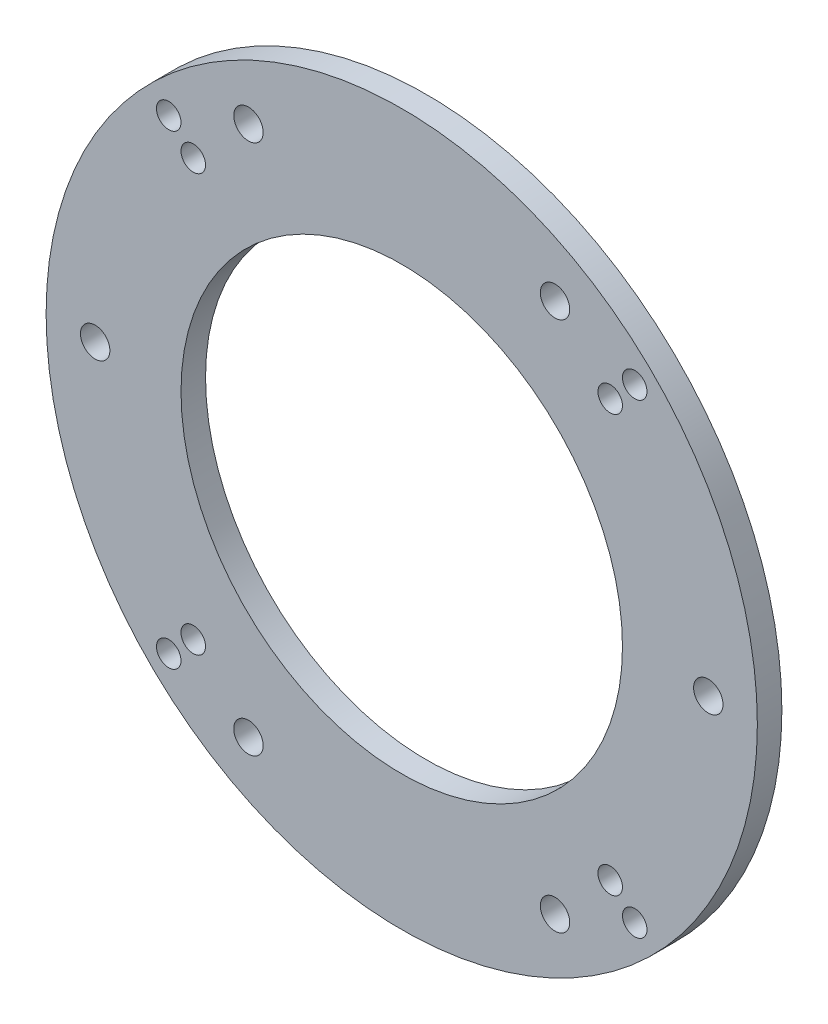
from build123d import *

# Parameters (mm, degrees)
SKETCH1_R             = 18
BOSS_EXTRUDE1_DEPTH   = 2
F_2_0MM_DOWEL_HOLE1_D = 2
SKETCH5_R             = 1.2
CUT_EXTRUDE4_DEPTH    = 42.060930335


with BuildPart() as part:
    # Sketch1 → Boss-Extrude1 (new body)
    with BuildSketch(Plane.XY):
        with BuildLine():
            ThreePointArc((-29, 0), (0, -29), (29, 0))
            ThreePointArc((29, 0), (0, 29), (-29, 0))
        make_face()
        Circle(SKETCH1_R, mode=Mode.SUBTRACT)
    extrude(amount=BOSS_EXTRUDE1_DEPTH)

    # Ø2.0mm Dowel Hole1 (through all)
    with Locations(Plane(origin=(-19, 19, 2), x_dir=(1, 0, 0), z_dir=(0, 0, 1))):
        with Locations((0, 0), (2, -2), (36, -2), (38, 0), (36, -36), (38, -38), (0, -38), (2, -36)):
            Hole(F_2_0MM_DOWEL_HOLE1_D / 2)

    # Sketch5 → Cut-Extrude4 (cut, through all)
    with BuildSketch(Plane.XY):
        with Locations((-12.5, 21.650635095)):
            Circle(SKETCH5_R)
        with Locations((-25, 0)):
            Circle(SKETCH5_R)
        with Locations((25, 0)):
            Circle(SKETCH5_R)
        with Locations((-12.5, -21.650635095)):
            Circle(SKETCH5_R)
        with Locations((12.5, 21.650635095)):
            Circle(SKETCH5_R)
        with Locations((12.5, -21.650635095)):
            Circle(SKETCH5_R)
    extrude(amount=CUT_EXTRUDE4_DEPTH, mode=Mode.SUBTRACT)


solid = part.part
